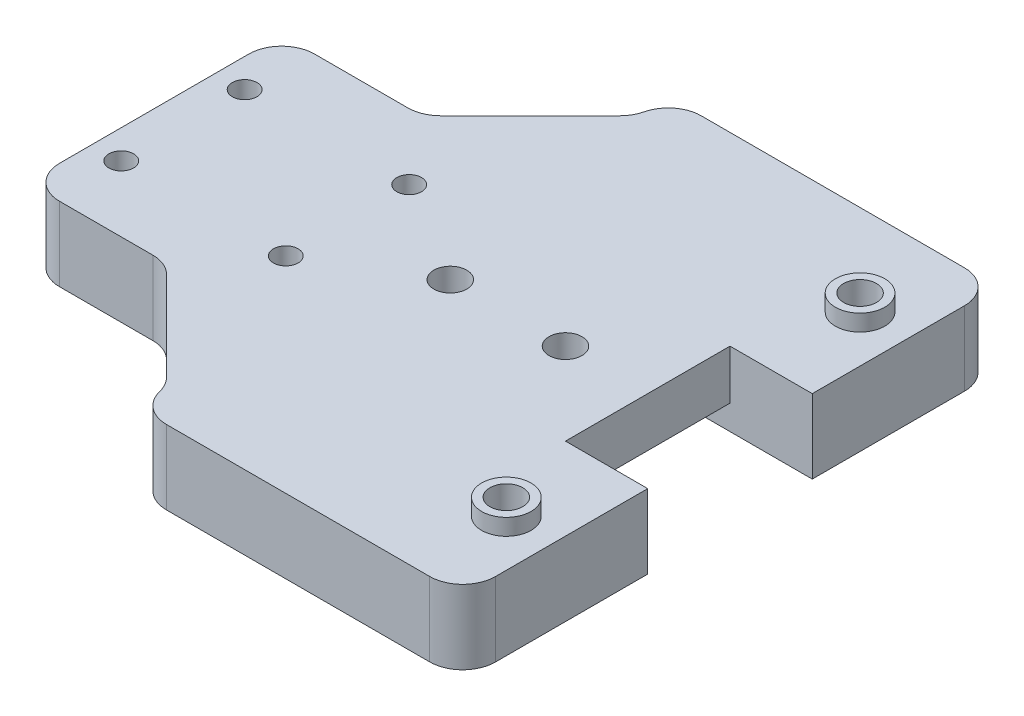
from build123d import *

# Parameters (mm, degrees)
SKETCH1_R               = 12
BOSS_EXTRUDE1_DEPTH     = 4.5
SKETCH2_R               = 1.7
CUT_EXTRUDE1_DEPTH      = 91.980767198
FILLET1_R               = 4
CUT_EXTRUDE4_DEPTH      = 91.980767198
SKETCH6_R               = 1.5
CUT_EXTRUDE5_DEPTH      = 41
CUT_EXTRUDE6_START      = -6
SKETCH7_W               = 30
SKETCH7_H               = 20
CUT_EXTRUDE6_DEPTH      = 3
SKETCH8_W               = 30
SKETCH8_H               = 17
CUT_EXTRUDE7_DEPTH      = 9
FILLET5_R               = 4
SKETCH10_W              = 10
SKETCH10_H              = 22.5
BOSS_EXTRUDE2_DEPTH     = 9
SKETCH13_R              = 3
BOSS_EXTRUDE4_DEPTH     = 2
CUT_EXTRUDE8_DEPTH      = 5
CUT_EXTRUDE8_DEPTH_BACK = 9
SKETCH11_R              = 2
FILLET6_R               = 4
BOSS_EXTRUDE3_DEPTH     = 9
FILLET8_R               = 4
SKETCH14_R              = 2
CUT_EXTRUDE9_DEPTH      = 16


with BuildPart() as part:
    # Sketch1 → Boss-Extrude1 (new, symmetric)
    with BuildSketch(Plane(origin=(0, 0, 0), x_dir=(1, 0, 0), z_dir=(0, 1, 0))):
        Polygon((21.5, 20), (21.5, -20), (-20.5, -32.5), (-84.5, -32.5), (-84.5, 32.5), (-20.5, 32.5), align=None)
        with Locations(Location((0, 0, 0), (0, 0, 270))):
            Circle(SKETCH1_R, mode=Mode.SUBTRACT)
    extrude(amount=BOSS_EXTRUDE1_DEPTH, both=True)

    # Sketch2 → Cut-Extrude1 (cut, through all)
    with BuildSketch(Plane(origin=(0, 4.5, 0), x_dir=(1, 0, 0), z_dir=(0, 1, 0))):
        with Locations(Location((15.5, 15.5, 0), (0, 0, 270))):
            Circle(SKETCH2_R)
        with Locations(Location((-15.5, 15.5, 0), (0, 0, 270))):
            Circle(SKETCH2_R)
        with Locations(Location((-15.5, -15.5, 0), (0, 0, 270))):
            Circle(SKETCH2_R)
        with Locations(Location((15.5, -15.5, 0), (0, 0, 270))):
            Circle(SKETCH2_R)
        with Locations(Location((-19.5, 27.5, 0), (0, 0, 270))):
            Circle(SKETCH2_R)
        with Locations(Location((-19.5, -27.5, 0), (0, 0, 270))):
            Circle(SKETCH2_R)
    extrude(amount=-CUT_EXTRUDE1_DEPTH, mode=Mode.SUBTRACT)

    # Fillet1
    fillet1_edges = [part.edges().sort_by_distance(p)[0] for p in [
        (-20.5, 0, 32.5),
        (-84.5, 0, 32.5),
        (-84.5, 0, -32.5),
        (-20.5, 0, -32.5),
        (21.5, 0, -20),
        (21.5, 0, 20),
    ]]
    fillet(fillet1_edges, radius=FILLET1_R)

    # Sketch5 → Cut-Extrude4 (cut, through all)
    with BuildSketch(Plane(origin=(0, 4.5, 0), x_dir=(1, 0, 0), z_dir=(0, 1, 0))):
        Polygon((-24.5, 32.5), (-24.5, 10), (-24.5, -10), (-24.5, -32.5), (26.912022907, -32.5), (26.912022907, 32.5), align=None)
    extrude(amount=-CUT_EXTRUDE4_DEPTH, mode=Mode.SUBTRACT)

    # Sketch6 → Cut-Extrude5 (cut)
    with BuildSketch(Plane.XZ.offset(4.5)):
        with Locations(Location((-81, -7.5, 0), (0, 0, 270))):
            Circle(SKETCH6_R)
        with Locations(Location((-81, 7.5, 0), (0, 0, 270))):
            Circle(SKETCH6_R)
        with Locations(Location((-61, -7.5, 0), (0, 0, 270))):
            Circle(SKETCH6_R)
        with Locations(Location((-61, 7.5, 0), (0, 0, 270))):
            Circle(SKETCH6_R)
    extrude(amount=-CUT_EXTRUDE5_DEPTH, mode=Mode.SUBTRACT)

    # Sketch7 → Cut-Extrude6 (cut)
    with BuildSketch(Plane(origin=(0, 4.5, 0), x_dir=(1, 0, 0), z_dir=(0, 1, 0)).offset(CUT_EXTRUDE6_START)):
        with Locations((-39.5, 0)):
            Rectangle(SKETCH7_W, SKETCH7_H)
    extrude(amount=-CUT_EXTRUDE6_DEPTH, mode=Mode.SUBTRACT)

    # Sketch8 → Cut-Extrude7 (cut)
    with BuildSketch(Plane(origin=(0, 4.5, 0), x_dir=(1, 0, 0), z_dir=(0, 1, 0))):
        with Locations((-69.5, 24)):
            Rectangle(SKETCH8_W, SKETCH8_H)
        with Locations((-69.5, -24)):
            Rectangle(SKETCH8_W, SKETCH8_H)
    extrude(amount=-CUT_EXTRUDE7_DEPTH, mode=Mode.SUBTRACT)

    # Fillet5
    fillet5_edges = [part.edges().sort_by_distance(p)[0] for p in [
        (-84.5, 0, -15.5),
        (-54.5, 0, -32.5),
        (-84.5, 0, 15.5),
        (-54.5, 0, 32.5),
    ]]
    fillet(fillet5_edges, radius=FILLET5_R)

    # Sketch10 → Boss-Extrude2 (add)
    with BuildSketch(Plane(origin=(0, 4.5, 0), x_dir=(1, 0, 0), z_dir=(0, 1, 0))):
        with Locations((-19.5, -21.25)):
            Rectangle(SKETCH10_W, SKETCH10_H)
        with Locations((-19.5, 21.25)):
            Rectangle(SKETCH10_W, SKETCH10_H)
    extrude(amount=-BOSS_EXTRUDE2_DEPTH)

    # Sketch13 → Boss-Extrude4 (add)
    with BuildSketch(Plane(origin=(0, 4.5, 0), x_dir=(1, 0, 0), z_dir=(0, 1, 0))):
        with Locations(Location((-20.19, -21.5, 0), (0, 0, 90))):
            Circle(SKETCH13_R)
        with Locations(Location((-20.19, 21.5, 0), (0, 0, 90))):
            Circle(SKETCH13_R)
    extrude(amount=BOSS_EXTRUDE4_DEPTH)

    # Sketch11 → Cut-Extrude8 (cut, two sides: drawn at the far end of the back side and taken through both)
    with BuildSketch(Plane(origin=(0, 4.5, 0), x_dir=(1, 0, 0), z_dir=(0, 1, 0)).offset(-CUT_EXTRUDE8_DEPTH_BACK)):
        with Locations(Location((-20.19, -21.5, 0), (0, 0, 270))):
            Circle(SKETCH11_R)
        with Locations(Location((-20.19, 21.5, 0), (0, 0, 90))):
            Circle(SKETCH11_R)
    extrude(amount=CUT_EXTRUDE8_DEPTH + CUT_EXTRUDE8_DEPTH_BACK, mode=Mode.SUBTRACT)

    # Fillet6
    fillet6_edges = [part.edges().sort_by_distance(p)[0] for p in [
        (-14.5, 0, 32.5),
        (-14.5, 0, -32.5),
    ]]
    fillet(fillet6_edges, radius=FILLET6_R)

    # Sketch12 → Boss-Extrude3 (add)
    with BuildSketch(Plane(origin=(0, 4.5, 0), x_dir=(1, 0, 0), z_dir=(0, 1, 0))):
        Polygon((-54.5, 28.5), (-67.5, 15.5), (-54.5, 15.5), align=None)
        Polygon((-54.5, -28.5), (-67.5, -15.5), (-54.5, -15.5), align=None)
    extrude(amount=-BOSS_EXTRUDE3_DEPTH)

    # Fillet8
    fillet8_edges = [part.edges().sort_by_distance(p)[0] for p in [
        (-54.5, 0, -28.5),
        (-54.5, 0, 28.5),
        (-67.5, 0, -15.5),
        (-67.5, 0, 15.5),
    ]]
    fillet(fillet8_edges, radius=FILLET8_R)

    # Sketch14 → Cut-Extrude9 (cut)
    with BuildSketch(Plane.XZ.offset(1.5)):
        with Locations(Location((-48.5, 0, 0), (0, 0, 270))):
            Circle(SKETCH14_R)
        with Locations(Location((-34.5, 0, 0), (0, 0, 270))):
            Circle(SKETCH14_R)
    extrude(amount=-CUT_EXTRUDE9_DEPTH, mode=Mode.SUBTRACT)


solid = part.part
